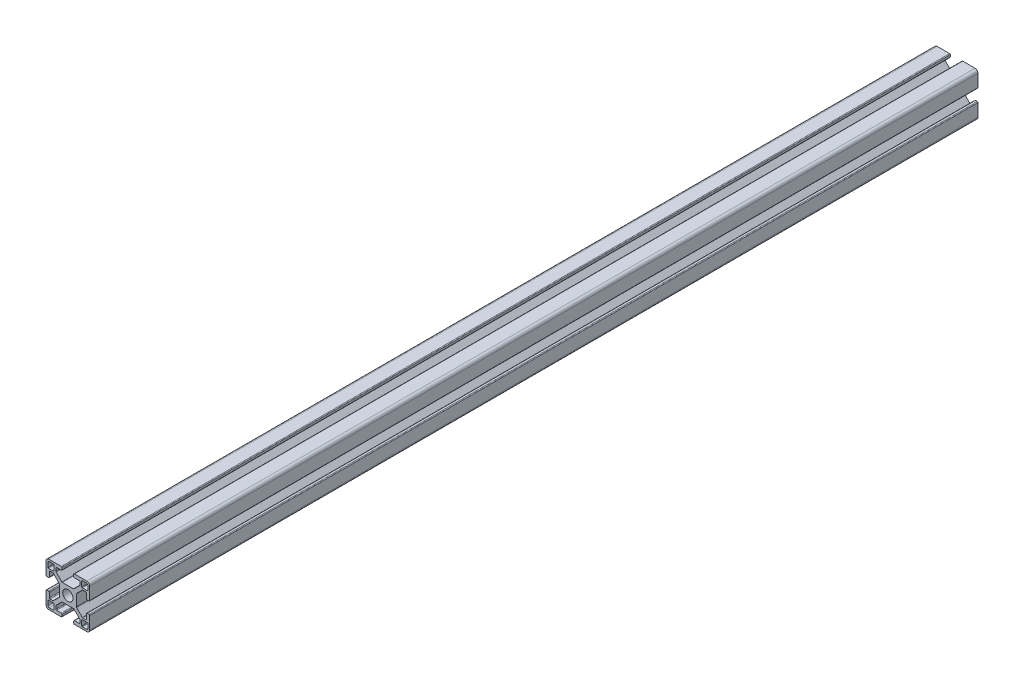
from build123d import *

# Parameters (mm, degrees)
SKETCH1_R           = 3.52998588
BOSS_EXTRUDE1_DEPTH = 304.8


with BuildPart() as part:
    # Sketch1 → Boss-Extrude1 (new, symmetric)
    with BuildSketch(Plane.XY):
        with BuildLine():
            Line((14.49994, -4), (13.24247465, -4))
            ThreePointArc((13.24247465, -4), (12.88892126, -4.146446609), (12.74247465, -4.5))
            Line((12.74247465, -4.5), (12.74247465, -7.732519321))
            ThreePointArc((12.74247465, -7.732519321), (12.602449697, -8.097296796), (12.242781236, -8.249967))
            Line((12.242781236, -8.249967), (10.260188032, -8.249967))
            ThreePointArc((10.260188032, -8.249967), (10.068847082, -8.211906919), (9.906636056, -8.103520976))
            Line((9.906636056, -8.103520976), (5.981117769, -4.178002689))
            ThreePointArc((5.981117769, -4.178002689), (5.872731827, -4.015791664), (5.834671745, -3.824450713))
            Line((5.834671745, -3.824450713), (5.834671745, -1.01249595))
            Line((5.834671745, -1.01249595), (5.834671745, 0.88749645))
            Line((5.834671745, 0.88749645), (5.834671745, 3.824450713))
            ThreePointArc((5.834671745, 3.824450713), (5.872731827, 4.015791664), (5.981117769, 4.178002689))
            Line((5.981117769, 4.178002689), (9.906636056, 8.103520976))
            ThreePointArc((9.906636056, 8.103520976), (10.068847082, 8.211906919), (10.260188032, 8.249967))
            Line((10.260188032, 8.249967), (12.242781236, 8.249967))
            ThreePointArc((12.242781236, 8.249967), (12.602449697, 8.097296796), (12.74247465, 7.732519321))
            Line((12.74247465, 7.732519321), (12.74247465, 4.5))
            ThreePointArc((12.74247465, 4.5), (12.88892126, 4.146446609), (13.24247465, 4))
            Line((13.24247465, 4), (14.49994, 4))
            ThreePointArc((14.49994, 4), (14.853493391, 4.146446609), (14.99994, 4.5))
            Line((14.99994, 4.5), (14.99994, 12.999948))
            ThreePointArc((14.99994, 12.999948), (14.414155906, 14.414155906), (12.999948, 14.99994))
            Line((12.999948, 14.99994), (4.5, 14.99994))
            ThreePointArc((4.5, 14.99994), (4.146446609, 14.853493391), (4, 14.49994))
            Line((4, 14.49994), (4, 13.24247465))
            ThreePointArc((4, 13.24247465), (4.146446609, 12.88892126), (4.5, 12.74247465))
            Line((4.5, 12.74247465), (7.732519321, 12.74247465))
            ThreePointArc((7.732519321, 12.74247465), (8.097296796, 12.602449697), (8.249967, 12.242781236))
            Line((8.249967, 12.242781236), (8.249967, 10.260188032))
            ThreePointArc((8.249967, 10.260188032), (8.211906919, 10.068847082), (8.103520976, 9.906636056))
            Line((8.103520976, 9.906636056), (4.178002689, 5.981117769))
            ThreePointArc((4.178002689, 5.981117769), (4.015791664, 5.872731827), (3.824450713, 5.834671745))
            Line((3.824450713, 5.834671745), (0.9499962, 5.834671745))
            Line((0.9499962, 5.834671745), (-0.9499962, 5.834671745))
            Line((-0.9499962, 5.834671745), (-3.824450713, 5.834671745))
            ThreePointArc((-3.824450713, 5.834671745), (-4.015791664, 5.872731827), (-4.178002689, 5.981117769))
            Line((-4.178002689, 5.981117769), (-8.103520976, 9.906636056))
            ThreePointArc((-8.103520976, 9.906636056), (-8.211906919, 10.068847082), (-8.249967, 10.260188032))
            Line((-8.249967, 10.260188032), (-8.249967, 12.242781236))
            ThreePointArc((-8.249967, 12.242781236), (-8.097296796, 12.602449697), (-7.732519321, 12.74247465))
            Line((-7.732519321, 12.74247465), (-4.5, 12.74247465))
            ThreePointArc((-4.5, 12.74247465), (-4.146446609, 12.88892126), (-4, 13.24247465))
            Line((-4, 13.24247465), (-4, 14.49994))
            ThreePointArc((-4, 14.49994), (-4.146446609, 14.853493391), (-4.5, 14.99994))
            Line((-4.5, 14.99994), (-12.999948, 14.99994))
            ThreePointArc((-12.999948, 14.99994), (-14.414155906, 14.414155906), (-14.99994, 12.999948))
            Line((-14.99994, 12.999948), (-14.99994, 4.5))
            ThreePointArc((-14.99994, 4.5), (-14.853493391, 4.146446609), (-14.49994, 4))
            Line((-14.49994, 4), (-13.24247465, 4))
            ThreePointArc((-13.24247465, 4), (-12.88892126, 4.146446609), (-12.74247465, 4.5))
            Line((-12.74247465, 4.5), (-12.74247465, 7.732519321))
            ThreePointArc((-12.74247465, 7.732519321), (-12.602449697, 8.097296796), (-12.242781236, 8.249967))
            Line((-12.242781236, 8.249967), (-10.260188032, 8.249967))
            ThreePointArc((-10.260188032, 8.249967), (-10.068847082, 8.211906919), (-9.906636056, 8.103520976))
            Line((-9.906636056, 8.103520976), (-5.981117769, 4.178002689))
            ThreePointArc((-5.981117769, 4.178002689), (-5.872731827, 4.015791664), (-5.834671745, 3.824450713))
            Line((-5.834671745, 3.824450713), (-5.834671745, 0.88749645))
            Line((-5.834671745, 0.88749645), (-5.834671745, -1.01249595))
            Line((-5.834671745, -1.01249595), (-5.834671745, -3.824450713))
            ThreePointArc((-5.834671745, -3.824450713), (-5.872731827, -4.015791664), (-5.981117769, -4.178002689))
            Line((-5.981117769, -4.178002689), (-9.906636056, -8.103520976))
            ThreePointArc((-9.906636056, -8.103520976), (-10.068847082, -8.211906919), (-10.260188032, -8.249967))
            Line((-10.260188032, -8.249967), (-12.242781236, -8.249967))
            ThreePointArc((-12.242781236, -8.249967), (-12.602449697, -8.097296796), (-12.74247465, -7.732519321))
            Line((-12.74247465, -7.732519321), (-12.74247465, -4.5))
            ThreePointArc((-12.74247465, -4.5), (-12.88892126, -4.146446609), (-13.24247465, -4))
            Line((-13.24247465, -4), (-14.49994, -4))
            ThreePointArc((-14.49994, -4), (-14.853493391, -4.146446609), (-14.99994, -4.5))
            Line((-14.99994, -4.5), (-14.99994, -12.999948))
            ThreePointArc((-14.99994, -12.999948), (-14.414155906, -14.414155906), (-12.999948, -14.99994))
            Line((-12.999948, -14.99994), (-4.5, -14.99994))
            ThreePointArc((-4.5, -14.99994), (-4.146446609, -14.853493391), (-4, -14.49994))
            Line((-4, -14.49994), (-4, -13.24247465))
            ThreePointArc((-4, -13.24247465), (-4.146446609, -12.88892126), (-4.5, -12.74247465))
            Line((-4.5, -12.74247465), (-7.732519321, -12.74247465))
            ThreePointArc((-7.732519321, -12.74247465), (-8.097296796, -12.602449697), (-8.249967, -12.242781236))
            Line((-8.249967, -12.242781236), (-8.249967, -10.260188032))
            ThreePointArc((-8.249967, -10.260188032), (-8.211906919, -10.068847082), (-8.103520976, -9.906636056))
            Line((-8.103520976, -9.906636056), (-4.178002689, -5.981117769))
            ThreePointArc((-4.178002689, -5.981117769), (-4.015791664, -5.872731827), (-3.824450713, -5.834671745))
            Line((-3.824450713, -5.834671745), (-0.9499962, -5.834671745))
            Line((-0.9499962, -5.834671745), (0.9499962, -5.834671745))
            Line((0.9499962, -5.834671745), (3.824450713, -5.834671745))
            ThreePointArc((3.824450713, -5.834671745), (4.015791664, -5.872731827), (4.178002689, -5.981117769))
            Line((4.178002689, -5.981117769), (8.103520976, -9.906636056))
            ThreePointArc((8.103520976, -9.906636056), (8.211906919, -10.068847082), (8.249967, -10.260188032))
            Line((8.249967, -10.260188032), (8.249967, -12.242781236))
            ThreePointArc((8.249967, -12.242781236), (8.097296796, -12.602449697), (7.732519321, -12.74247465))
            Line((7.732519321, -12.74247465), (4.5, -12.74247465))
            ThreePointArc((4.5, -12.74247465), (4.146446609, -12.88892126), (4, -13.24247465))
            Line((4, -13.24247465), (4, -14.49994))
            ThreePointArc((4, -14.49994), (4.146446609, -14.853493391), (4.5, -14.99994))
            Line((4.5, -14.99994), (12.999948, -14.99994))
            ThreePointArc((12.999948, -14.99994), (14.414155906, -14.414155906), (14.99994, -12.999948))
            Line((14.99994, -12.999948), (14.99994, -4.5))
            ThreePointArc((14.99994, -4.5), (14.853493391, -4.146446609), (14.49994, -4))
        make_face()
        Circle(SKETCH1_R, mode=Mode.SUBTRACT)
        with BuildLine():
            Line((-12.6999492, -13.6999452), (-9.880960476, -13.6999452))
            ThreePointArc((-9.880960476, -13.6999452), (-9.61155387, -13.58835333), (-9.499962, -13.318946724))
            Line((-9.499962, -13.318946724), (-9.499962, -9.87996048))
            ThreePointArc((-9.499962, -9.87996048), (-9.611260978, -9.611260978), (-9.87996048, -9.499962))
            Line((-9.87996048, -9.499962), (-13.318946724, -9.499962))
            ThreePointArc((-13.318946724, -9.499962), (-13.58835333, -9.61155387), (-13.6999452, -9.880960476))
            Line((-13.6999452, -9.880960476), (-13.6999452, -12.6999492))
            ThreePointArc((-13.6999452, -12.6999492), (-13.407053153, -13.407053153), (-12.6999492, -13.6999452))
        make_face(mode=Mode.SUBTRACT)
        with BuildLine():
            Line((13.6999452, -12.6999492), (13.6999452, -9.880960476))
            ThreePointArc((13.6999452, -9.880960476), (13.58835333, -9.61155387), (13.318946724, -9.499962))
            Line((13.318946724, -9.499962), (9.87996048, -9.499962))
            ThreePointArc((9.87996048, -9.499962), (9.611260978, -9.611260978), (9.499962, -9.87996048))
            Line((9.499962, -9.87996048), (9.499962, -13.318946724))
            ThreePointArc((9.499962, -13.318946724), (9.61155387, -13.58835333), (9.880960476, -13.6999452))
            Line((9.880960476, -13.6999452), (12.6999492, -13.6999452))
            ThreePointArc((12.6999492, -13.6999452), (13.407053153, -13.407053153), (13.6999452, -12.6999492))
        make_face(mode=Mode.SUBTRACT)
        with BuildLine():
            Line((9.87996048, 9.499962), (13.318946724, 9.499962))
            ThreePointArc((13.318946724, 9.499962), (13.58835333, 9.61155387), (13.6999452, 9.880960476))
            Line((13.6999452, 9.880960476), (13.6999452, 12.6999492))
            ThreePointArc((13.6999452, 12.6999492), (13.407053153, 13.407053153), (12.6999492, 13.6999452))
            Line((12.6999492, 13.6999452), (9.880960476, 13.6999452))
            ThreePointArc((9.880960476, 13.6999452), (9.61155387, 13.58835333), (9.499962, 13.318946724))
            Line((9.499962, 13.318946724), (9.499962, 9.87996048))
            ThreePointArc((9.499962, 9.87996048), (9.611260978, 9.611260978), (9.87996048, 9.499962))
        make_face(mode=Mode.SUBTRACT)
        with BuildLine():
            Line((-13.6999452, 12.6999492), (-13.6999452, 9.880960476))
            ThreePointArc((-13.6999452, 9.880960476), (-13.58835333, 9.61155387), (-13.318946724, 9.499962))
            Line((-13.318946724, 9.499962), (-9.87996048, 9.499962))
            ThreePointArc((-9.87996048, 9.499962), (-9.611260978, 9.611260978), (-9.499962, 9.87996048))
            Line((-9.499962, 9.87996048), (-9.499962, 13.318946724))
            ThreePointArc((-9.499962, 13.318946724), (-9.61155387, 13.58835333), (-9.880960476, 13.6999452))
            Line((-9.880960476, 13.6999452), (-12.6999492, 13.6999452))
            ThreePointArc((-12.6999492, 13.6999452), (-13.407053153, 13.407053153), (-13.6999452, 12.6999492))
        make_face(mode=Mode.SUBTRACT)
    extrude(amount=BOSS_EXTRUDE1_DEPTH, both=True)


solid = part.part
